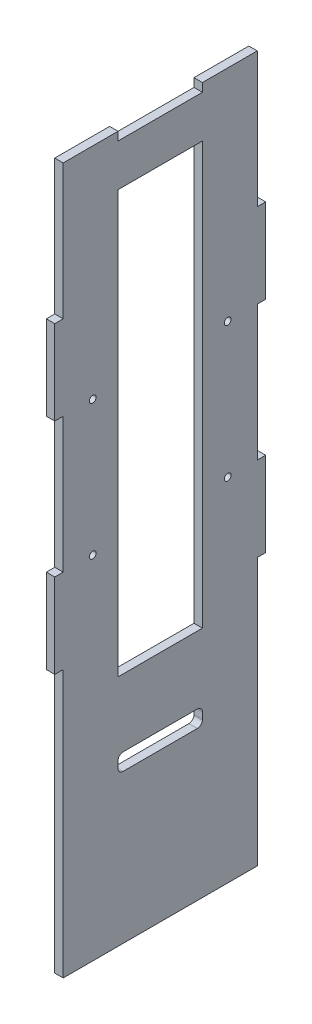
from build123d import *

# Parameters (mm, degrees)
SKETCH_1_R      = 2
SKETCH_1_W      = 50
SKETCH_1_H      = 250
EXTRUDE_1_DEPTH = 5


with BuildPart() as part:
    # 草图1 → 凸台-拉伸1 (new body)
    with BuildSketch(Plane(origin=(0, 0, 0), x_dir=(0, 0, -1), z_dir=(1, 0, 0))):
        Polygon((-115, 195), (-115, 275), (-82.5, 275), (-82.5, 270), (-32.5, 270), (-32.5, 275), (0, 275), (0, 195), (5, 195), (5, 144.996887482), (0, 144.996887482), (0, 64.996887482), (5, 64.996887482), (5, 14.996887482), (0, 14.996887482), (0, 0), (0, -117.3), (0, -143.3), (-115, -143.3), (-115, -117.3), (-115, 0), (-115, 15), (-120, 15), (-120, 65), (-115, 65), (-115, 145), (-120, 145), (-120, 195), align=None)
        with Locations((-97.5, 145)):
            Circle(SKETCH_1_R, mode=Mode.SUBTRACT)
        with Locations((-17.5, 144.996887482)):
            Circle(SKETCH_1_R, mode=Mode.SUBTRACT)
        with Locations((-17.5, 64.996887482)):
            Circle(SKETCH_1_R, mode=Mode.SUBTRACT)
        with Locations((-97.5, 64.996887482)):
            Circle(SKETCH_1_R, mode=Mode.SUBTRACT)
        with Locations((-57.5, 120)):
            Rectangle(SKETCH_1_W, SKETCH_1_H, mode=Mode.SUBTRACT)
        with BuildLine():
            Line((-79.5, -45), (-35.5, -45))
            ThreePointArc((-35.5, -45), (-33.378679656, -45.878679656), (-32.5, -48))
            Line((-32.5, -48), (-32.5, -52))
            ThreePointArc((-32.5, -52), (-33.378679656, -54.121320344), (-35.5, -55))
            Line((-35.5, -55), (-79.5, -55))
            ThreePointArc((-79.5, -55), (-81.621320344, -54.121320344), (-82.5, -52))
            Line((-82.5, -52), (-82.5, -48))
            ThreePointArc((-82.5, -48), (-81.621320344, -45.878679656), (-79.5, -45))
        make_face(mode=Mode.SUBTRACT)
    extrude(amount=EXTRUDE_1_DEPTH)


solid = part.part
